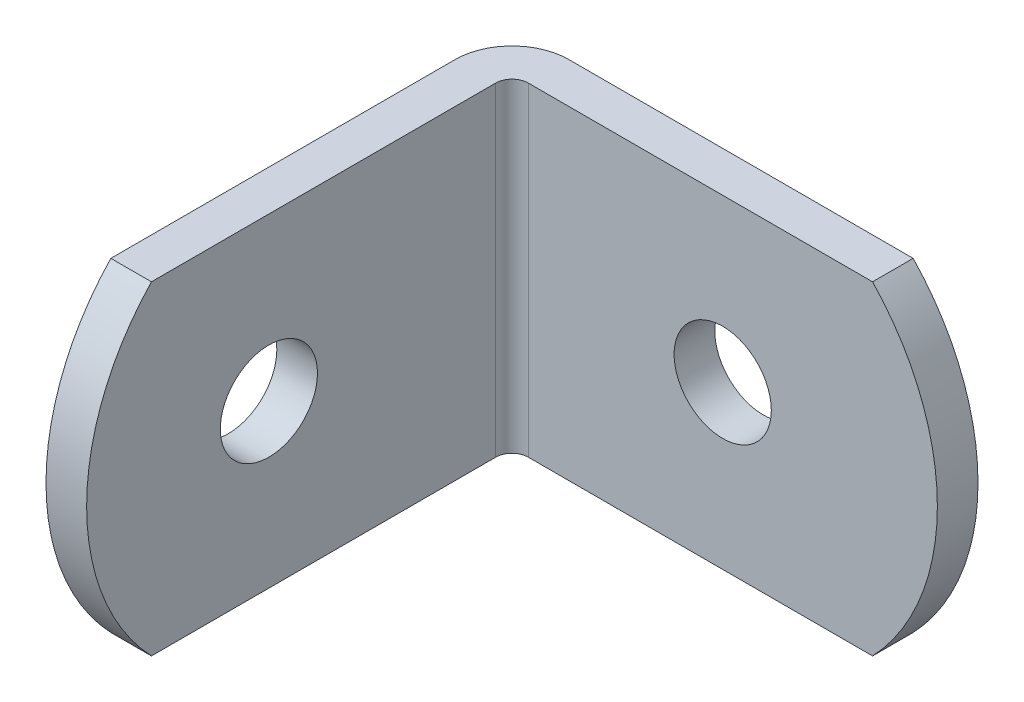
from build123d import *

# Parameters (mm, degrees)
EXTRUDE_THIN1_DEPTH     = 8.001
CUT_EXTRUDE1_DEPTH      = 33.168776607
CUT_EXTRUDE1_DEPTH_BACK = 33.168776607
SKETCH7_R               = 2.4
CUT_EXTRUDE3_DEPTH      = 33.168776607
CUT_EXTRUDE2_DEPTH      = 33.168776607
CUT_EXTRUDE2_DEPTH_BACK = 33.168776607
SKETCH8_R               = 2.4
CUT_EXTRUDE4_DEPTH      = 33.168776607


with BuildPart() as part:
    # Sketch4 → Extrude-Thin1 (new, symmetric)
    with BuildSketch(Plane(origin=(0, 0, 0), x_dir=(1, 0, 0), z_dir=(0, 1, 0))):
        with BuildLine():
            Line((23.0124, 0), (2.80924, 0))
            ThreePointArc((2.80924, 0), (0.822807346, -0.822807346), (0, -2.80924))
            Line((0, -2.80924), (0, -23.0124))
            Line((0, -23.0124), (2.0066, -23.0124))
            Line((2.0066, -23.0124), (2.0066, -2.80924))
            ThreePointArc((2.0066, -2.80924), (2.241687813, -2.241687813), (2.80924, -2.0066))
            Line((2.80924, -2.0066), (23.0124, -2.0066))
            Line((23.0124, -2.0066), (23.0124, 0))
        make_face()
    extrude(amount=EXTRUDE_THIN1_DEPTH, both=True)

    # Sketch5 → Cut-Extrude1 (cut, two sides: drawn at the far end of the back side and taken through both)
    with BuildSketch(Plane(origin=(2.0066, 0, 0), x_dir=(0, 0, -1), z_dir=(1, 0, 0)).offset(-CUT_EXTRUDE1_DEPTH_BACK)):
        with BuildLine():
            Line((22.211753172, 52.125940831), (-19.812, 8.001))
            ThreePointArc((-19.812, 8.001), (-23.0124, 0), (-19.812, -8.001))
            Line((-19.812, -8.001), (22.211753172, -52.125940831))
            Line((22.211753172, -52.125940831), (-99.657131027, -52.125940831))
            Line((-99.657131027, -52.125940831), (-99.657131027, 52.125940831))
            Line((-99.657131027, 52.125940831), (22.211753172, 52.125940831))
        make_face()
    extrude(amount=CUT_EXTRUDE1_DEPTH + CUT_EXTRUDE1_DEPTH_BACK, mode=Mode.SUBTRACT)

    # Sketch7 → Cut-Extrude3 (cut, through all)
    with BuildSketch(Plane(origin=(2.0066, 0, 0), x_dir=(0, 0, -1), z_dir=(1, 0, 0))):
        with Locations((-14.0124, 0)):
            Circle(SKETCH7_R)
    extrude(amount=-CUT_EXTRUDE3_DEPTH, mode=Mode.SUBTRACT)

    # Sketch6 → Cut-Extrude2 (cut, two sides: drawn at the far end of the back side and taken through both)
    with BuildSketch(Plane.XY.offset(2.0066).offset(-CUT_EXTRUDE2_DEPTH_BACK)):
        with BuildLine():
            Line((-22.211753172, -52.125940831), (19.812, -8.001))
            ThreePointArc((19.812, -8.001), (23.0124, 0), (19.812, 8.001))
            Line((19.812, 8.001), (-22.211753172, 52.125940831))
            Line((-22.211753172, 52.125940831), (99.657131027, 52.125940831))
            Line((99.657131027, 52.125940831), (99.657131027, -52.125940831))
            Line((99.657131027, -52.125940831), (-22.211753172, -52.125940831))
        make_face()
    extrude(amount=CUT_EXTRUDE2_DEPTH + CUT_EXTRUDE2_DEPTH_BACK, mode=Mode.SUBTRACT)

    # Sketch8 → Cut-Extrude4 (cut, through all)
    with BuildSketch(Plane.XY.offset(2.0066)):
        with Locations((12.4124, 0)):
            Circle(SKETCH8_R)
    extrude(amount=-CUT_EXTRUDE4_DEPTH, mode=Mode.SUBTRACT)


solid = part.part
